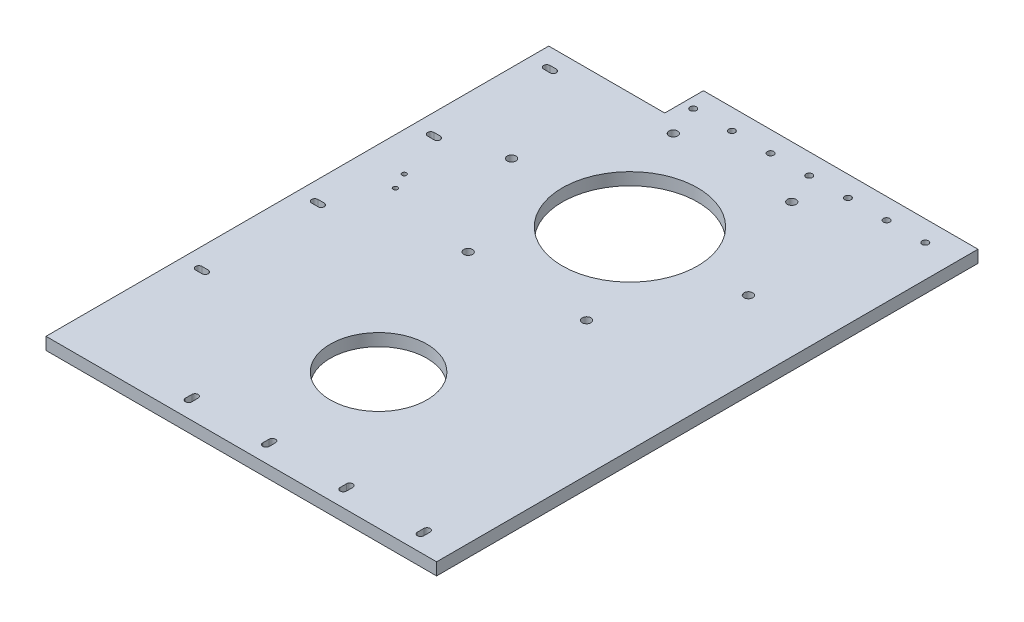
from build123d import *

# Parameters (mm, degrees)
BOSS_EXTRUDE1_DEPTH = 6.35
SKETCH9_R           = 1.65
CUT_EXTRUDE10_DEPTH = 30
CUT_EXTRUDE12_DEPTH = 30
SKETCH10_R          = 1.65
CUT_EXTRUDE13_DEPTH = 10
SKETCH12_R          = 35
CUT_EXTRUDE14_DEPTH = 192.836707905
SKETCH13_R          = 2.25
CUT_EXTRUDE15_DEPTH = 192.836707905
SKETCH14_R          = 25
CUT_EXTRUDE16_DEPTH = 10
SKETCH15_R          = 1.175
CUT_EXTRUDE17_DEPTH = 10


with BuildPart() as part:
    # Sketch1 → Boss-Extrude1 (new body)
    with BuildSketch(Plane(origin=(0, 0, 0), x_dir=(1, 0, 0), z_dir=(0, 1, 0))):
        Polygon((-71, 140), (71, 140), (71, -140), (-131, -140), (-131, 120), (-71, 120), align=None)
    extrude(amount=BOSS_EXTRUDE1_DEPTH)

    # Sketch9 → Cut-Extrude10 (cut)
    with BuildSketch(Plane(origin=(0, 0, 0), x_dir=(-1, 0, 0), z_dir=(0, -1, 0))):
        with Locations(Location((45.6, 129.325, 0), (0, 0, 90))):
            Circle(SKETCH9_R)
        with Locations(Location((5.6, 129.325, 0), (0, 0, 90))):
            Circle(SKETCH9_R)
        with Locations(Location((-34.4, 129.325, 0), (0, 0, 90))):
            Circle(SKETCH9_R)
        with Locations(Location((65.6, 129.325, 0), (0, 0, 90))):
            Circle(SKETCH9_R)
        with Locations(Location((25.6, 129.325, 0), (0, 0, 90))):
            Circle(SKETCH9_R)
        with Locations(Location((-14.4, 129.325, 0), (0, 0, 90))):
            Circle(SKETCH9_R)
        with Locations(Location((-54.4, 129.325, 0), (0, 0, 90))):
            Circle(SKETCH9_R)
    extrude(amount=-CUT_EXTRUDE10_DEPTH, mode=Mode.SUBTRACT)

    # Sketch11 → Cut-Extrude12 (cut)
    with BuildSketch(Plane(origin=(0, 6.35, 0), x_dir=(1, 0, 0), z_dir=(0, 1, 0))):
        with BuildLine():
            Line((-63.95, -128.355), (-63.95, -131.655))
            ThreePointArc((-63.95, -131.655), (-65.6, -133.305), (-67.25, -131.655))
            Line((-67.25, -131.655), (-67.25, -128.355))
            ThreePointArc((-67.25, -128.355), (-65.6, -126.705), (-63.95, -128.355))
        make_face()
        with BuildLine():
            Line((-23.95, -128.353535871), (-23.95, -131.653535871))
            ThreePointArc((-23.95, -131.653535871), (-25.6, -133.303535871), (-27.25, -131.653535871))
            Line((-27.25, -131.653535871), (-27.25, -128.353535871))
            ThreePointArc((-27.25, -128.353535871), (-25.6, -126.703535871), (-23.95, -128.353535871))
        make_face()
        with BuildLine():
            Line((16.05, -128.352071742), (16.05, -131.652071742))
            ThreePointArc((16.05, -131.652071742), (14.4, -133.302071742), (12.75, -131.652071742))
            Line((12.75, -131.652071742), (12.75, -128.352071742))
            ThreePointArc((12.75, -128.352071742), (14.4, -126.702071742), (16.05, -128.352071742))
        make_face()
        with BuildLine():
            Line((56.05, -128.350607613), (56.05, -131.650607613))
            ThreePointArc((56.05, -131.650607613), (54.4, -133.300607613), (52.75, -131.650607613))
            Line((52.75, -131.650607613), (52.75, -128.350607613))
            ThreePointArc((52.75, -128.350607613), (54.4, -126.700607613), (56.05, -128.350607613))
        make_face()
    extrude(amount=-CUT_EXTRUDE12_DEPTH, mode=Mode.SUBTRACT)

    # Sketch10 → Cut-Extrude13 (cut)
    with BuildSketch(Plane.XZ):
        with Locations((-120.325, -110)):
            Circle(SKETCH10_R)
        with BuildLine():
            Line((-118.675, -108.35), (-120.325, -108.35))
            ThreePointArc((-120.325, -108.35), (-119.158273811, -108.833273811), (-118.675, -110))
            ThreePointArc((-118.675, -110), (-119.158273801, -111.166726179), (-120.324999972, -111.65))
            Line((-120.324999972, -111.65), (-118.675, -111.65))
            ThreePointArc((-118.675, -111.65), (-117.025, -110), (-118.675, -108.35))
        make_face()
        with BuildLine():
            Line((-120.325, -108.35), (-121.975, -108.35))
            ThreePointArc((-121.975, -108.35), (-123.625, -110), (-121.975, -111.65))
            Line((-121.975, -111.65), (-120.324999972, -111.65))
            ThreePointArc((-120.324999972, -111.65), (-121.975, -110.000000014), (-120.325, -108.35))
        make_face()
        with BuildLine():
            Line((-120.325, -48.35), (-121.975, -48.35))
            ThreePointArc((-121.975, -48.35), (-123.625, -50), (-121.975, -51.65))
            Line((-121.975, -51.65), (-120.325, -51.65))
            ThreePointArc((-120.325, -51.65), (-121.975, -50), (-120.325, -48.35))
        make_face()
        with Locations((-120.325, -50)):
            Circle(SKETCH10_R)
        with BuildLine():
            Line((-118.675, -48.35), (-120.325, -48.35))
            ThreePointArc((-120.325, -48.35), (-119.158273811, -48.833273811), (-118.675, -50))
            ThreePointArc((-118.675, -50), (-119.158273811, -51.166726189), (-120.325, -51.65))
            Line((-120.325, -51.65), (-118.675, -51.65))
            ThreePointArc((-118.675, -51.65), (-117.025, -50), (-118.675, -48.35))
        make_face()
        with BuildLine():
            Line((-120.325, 11.65), (-121.975, 11.65))
            ThreePointArc((-121.975, 11.65), (-123.625, 10), (-121.975, 8.35))
            Line((-121.975, 8.35), (-120.325, 8.35))
            ThreePointArc((-120.325, 8.35), (-121.975, 10), (-120.325, 11.65))
        make_face()
        with Locations((-120.325, 10)):
            Circle(SKETCH10_R)
        with BuildLine():
            Line((-118.675, 11.65), (-120.325, 11.65))
            ThreePointArc((-120.325, 11.65), (-119.158273811, 11.166726189), (-118.675, 10))
            ThreePointArc((-118.675, 10), (-119.158273811, 8.833273811), (-120.325, 8.35))
            Line((-120.325, 8.35), (-118.675, 8.35))
            ThreePointArc((-118.675, 8.35), (-117.025, 10), (-118.675, 11.65))
        make_face()
        with BuildLine():
            Line((-120.325, 71.65), (-121.975, 71.65))
            ThreePointArc((-121.975, 71.65), (-123.625, 70), (-121.975, 68.35))
            Line((-121.975, 68.35), (-120.325, 68.35))
            ThreePointArc((-120.325, 68.35), (-121.975, 70), (-120.325, 71.65))
        make_face()
        with Locations((-120.325, 70)):
            Circle(SKETCH10_R)
        with BuildLine():
            Line((-118.675, 71.65), (-120.325, 71.65))
            ThreePointArc((-120.325, 71.65), (-119.158273811, 71.166726189), (-118.675, 70))
            ThreePointArc((-118.675, 70), (-119.158273811, 68.833273811), (-120.325, 68.35))
            Line((-120.325, 68.35), (-118.675, 68.35))
            ThreePointArc((-118.675, 68.35), (-117.025, 70), (-118.675, 71.65))
        make_face()
    extrude(amount=-CUT_EXTRUDE13_DEPTH, mode=Mode.SUBTRACT)

    # Sketch12 → Cut-Extrude14 (cut, through all)
    with BuildSketch(Plane(origin=(0, 6.35, 0), x_dir=(1, 0, 0), z_dir=(0, 1, 0))):
        with Locations(Location((-29, 60, 0), (0, 0, 270))):
            Circle(SKETCH12_R)
    extrude(amount=-CUT_EXTRUDE14_DEPTH, mode=Mode.SUBTRACT)

    # Sketch13 → Cut-Extrude15 (cut, through all)
    with BuildSketch(Plane(origin=(0, 6.35, 0), x_dir=(1, 0, 0), z_dir=(0, 1, 0))):
        with Locations(Location((-90.25, 60, 0), (0, 0, 270))):
            Circle(SKETCH13_R)
        with Locations(Location((-59.625, 113.044055982, 0), (0, 0, 270))):
            Circle(SKETCH13_R)
        with Locations(Location((1.625, 113.044055982, 0), (0, 0, 270))):
            Circle(SKETCH13_R)
        with Locations(Location((32.25, 60, 0), (0, 0, 270))):
            Circle(SKETCH13_R)
        with Locations(Location((1.625, 6.955944018, 0), (0, 0, 270))):
            Circle(SKETCH13_R)
        with Locations(Location((-59.625, 6.955944018, 0), (0, 0, 270))):
            Circle(SKETCH13_R)
    extrude(amount=-CUT_EXTRUDE15_DEPTH, mode=Mode.SUBTRACT)

    # Sketch14 → Cut-Extrude16 (cut)
    with BuildSketch(Plane(origin=(0, 6.35, 0), x_dir=(1, 0, 0), z_dir=(0, 1, 0))):
        with Locations(Location((-29, -70, 0), (0, 0, 270))):
            Circle(SKETCH14_R)
    extrude(amount=-CUT_EXTRUDE16_DEPTH, mode=Mode.SUBTRACT)

    # Sketch15 → Cut-Extrude17 (cut)
    with BuildSketch(Plane(origin=(0, 6.35, 0), x_dir=(1, 0, 0), z_dir=(0, 1, 0))):
        with Locations(Location((-111.024467158, 25.298909731, 0), (0, 0, 270))):
            Circle(SKETCH15_R)
        with Locations(Location((-106.983736963, 16.701090269, 0), (0, 0, 270))):
            Circle(SKETCH15_R)
    extrude(amount=-CUT_EXTRUDE17_DEPTH, mode=Mode.SUBTRACT)


solid = part.part
